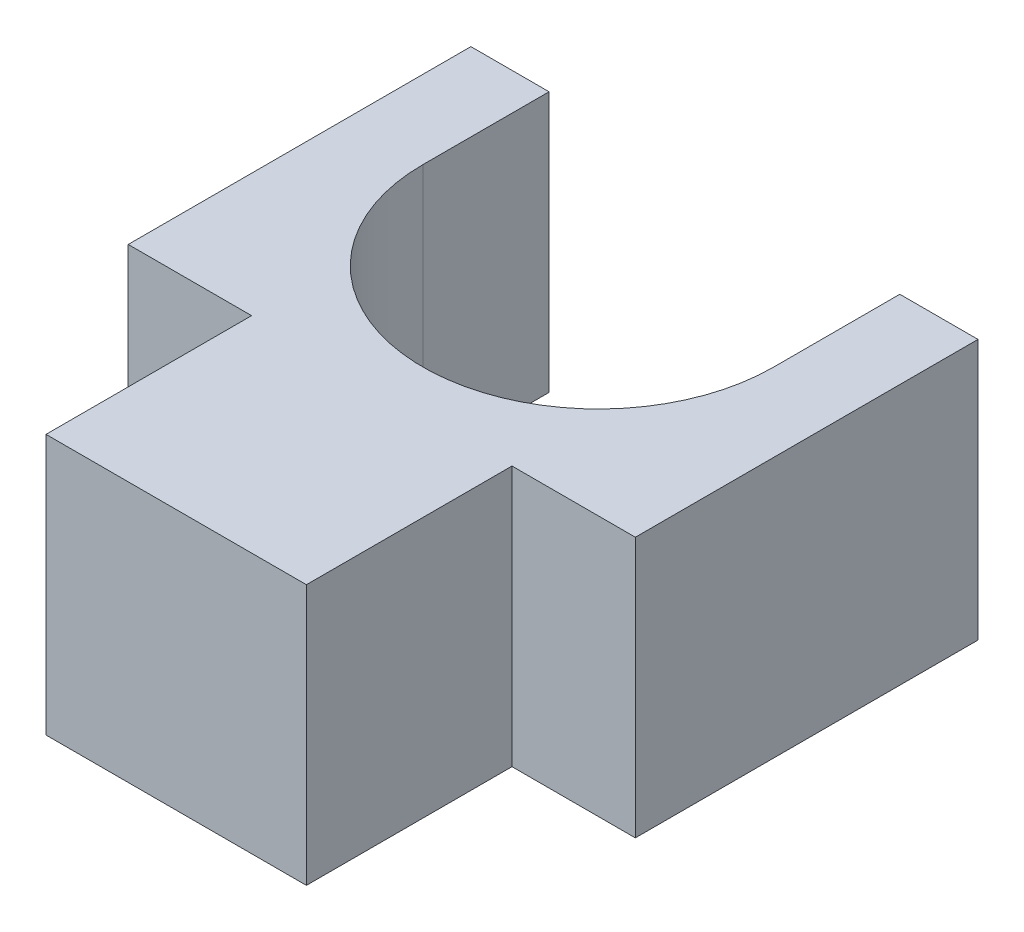
from build123d import *

# Parameters (mm, degrees)
BOSS_EXTRUDE1_DEPTH = 2.413


with BuildPart() as part:
    # Sketch1 → Boss-Extrude1 (new body)
    with BuildSketch(Plane(origin=(0, 0, 0), x_dir=(1, 0, 0), z_dir=(0, 1, 0))):
        with BuildLine():
            Line((1.2065, 0), (-1.2065, 0))
            Line((-1.2065, 0), (-1.2065, 1.905))
            Line((-1.2065, 1.905), (-2.3495, 1.905))
            Line((-2.3495, 1.905), (-2.3495, 5.08))
            Line((-2.3495, 5.08), (-1.625, 5.08))
            Line((-1.625, 5.08), (-1.625, 3.911))
            ThreePointArc((-1.625, 3.911), (0, 2.286), (1.625, 3.911))
            Line((1.625, 3.911), (1.625, 5.08))
            Line((1.625, 5.08), (2.3495, 5.08))
            Line((2.3495, 5.08), (2.3495, 1.905))
            Line((2.3495, 1.905), (1.2065, 1.905))
            Line((1.2065, 1.905), (1.2065, 0))
        make_face()
    extrude(amount=BOSS_EXTRUDE1_DEPTH)


solid = part.part
